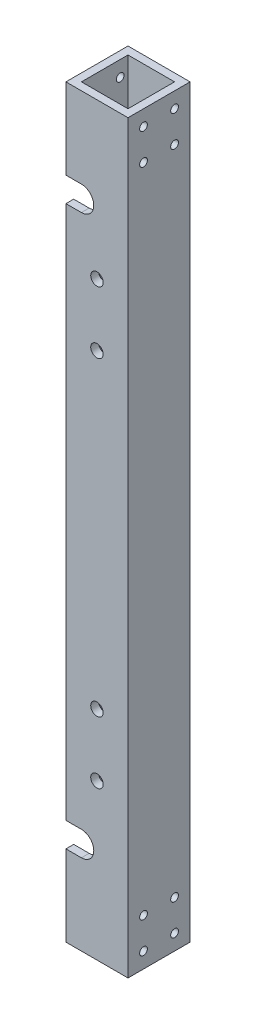
from build123d import *

# Parameters (mm, degrees)
SKETCH1_W                    = 25.4
SKETCH1_H                    = 25.4
SKETCH1_W_2                  = 19.05
SKETCH1_H_2                  = 19.05
BOSS_EXTRUDE1_DEPTH          = 304.8
CUT_EXTRUDE3_REACH           = 308.12
SKETCH4_W                    = 19.05
SKETCH4_H                    = 28.575
F_3_8_CLEARANCE_HOLE1_D      = 10.0838
F_1_8_0_125_DIAMETER_HOLE1_D = 3.175
F_10_CLEARANCE_HOLE1_D       = 5.1054
FILLET1_R                    = 4.7625
CUT_EXTRUDE4_DEPTH           = 307.120058147


with BuildPart() as part:
    # Sketch1 → Boss-Extrude1 (new body)
    with BuildSketch(Plane(origin=(0, 0, 0), x_dir=(1, 0, 0), z_dir=(0, 1, 0))):
        Rectangle(SKETCH1_W, SKETCH1_H)
        Rectangle(SKETCH1_W_2, SKETCH1_H_2, mode=Mode.SUBTRACT)
    extrude(amount=BOSS_EXTRUDE1_DEPTH)

    # Sketch4 → Cut-Extrude3 (cut, up to next)
    with BuildSketch(Plane.ZY.offset(12.7), mode=Mode.PRIVATE) as cut_extrude3_sk1:
        with Locations((0, 266.7)):
            Rectangle(SKETCH4_W, SKETCH4_H)
    cut_extrude3_tool1 = extrude(cut_extrude3_sk1.sketch, amount=-CUT_EXTRUDE3_REACH, mode=Mode.PRIVATE) & part.part
    # Sketch4 → Cut-Extrude3 (cut, up to next)
    with BuildSketch(Plane.ZY.offset(12.7), mode=Mode.PRIVATE) as cut_extrude3_sk2:
        with Locations((0, 38.1)):
            Rectangle(SKETCH4_W, SKETCH4_H)
    cut_extrude3_tool2 = extrude(cut_extrude3_sk2.sketch, amount=-CUT_EXTRUDE3_REACH, mode=Mode.PRIVATE) & part.part
    add(cut_extrude3_tool1.solids().sort_by_distance((-12.7, 266.7, 0))[0], mode=Mode.SUBTRACT)
    add(cut_extrude3_tool2.solids().sort_by_distance((-12.7, 38.1, 0))[0], mode=Mode.SUBTRACT)

    # 3/8 Clearance Hole1 (through all)
    with Locations(Plane.XY.offset(12.7)):
        with Locations((-6.35, 266.7), (-6.35, 38.1)):
            Hole(F_3_8_CLEARANCE_HOLE1_D / 2)

    # 1/8 (0.125) Diameter Hole1 (through all)
    with Locations(Plane.ZY.offset(12.7)):
        with Locations((6.35, 6.35), (6.35, 285.75), (-6.35, 298.45), (-6.35, 285.75), (6.35, 298.45), (6.35, 19.05), (-6.35, 19.05), (-6.35, 6.35)):
            Hole(F_1_8_0_125_DIAMETER_HOLE1_D / 2)

    # #10 Clearance Hole1 (through all)
    with Locations(Plane.XY.offset(12.7)):
        with Locations((0, 63.5), (0, 88.9), (0, 241.3), (0, 215.9)):
            Hole(F_10_CLEARANCE_HOLE1_D / 2)

    # Fillet1
    fillet1_edges = [part.edges().sort_by_distance(p)[0] for p in [
        (-11.1125, 280.9875, -9.525),
        (-11.1125, 252.4125, -9.525),
        (-11.1125, 252.4125, 9.525),
        (-11.1125, 280.9875, 9.525),
        (-11.1125, 52.3875, 9.525),
        (-11.1125, 52.3875, -9.525),
        (-11.1125, 23.8125, -9.525),
        (-11.1125, 23.8125, 9.525),
    ]]
    fillet(fillet1_edges, radius=FILLET1_R)

    # Sketch11 → Cut-Extrude4 (cut, through all)
    with BuildSketch(Plane.XY.offset(12.7)):
        with BuildLine():
            Line((-6.35, 261.6581), (-12.7, 261.6581))
            ThreePointArc((-12.7, 261.6581), (-17.7419, 266.7), (-12.7, 271.7419))
            Line((-12.7, 271.7419), (-6.35, 271.7419))
            ThreePointArc((-6.35, 271.7419), (-1.3081, 266.7), (-6.35, 261.6581))
        make_face()
        with BuildLine():
            Line((-6.35, 33.0581), (-12.7, 33.0581))
            ThreePointArc((-12.7, 33.0581), (-17.7419, 38.1), (-12.7, 43.1419))
            Line((-12.7, 43.1419), (-6.35, 43.1419))
            ThreePointArc((-6.35, 43.1419), (-1.3081, 38.1), (-6.35, 33.0581))
        make_face()
    extrude(amount=-CUT_EXTRUDE4_DEPTH, mode=Mode.SUBTRACT)


solid = part.part
